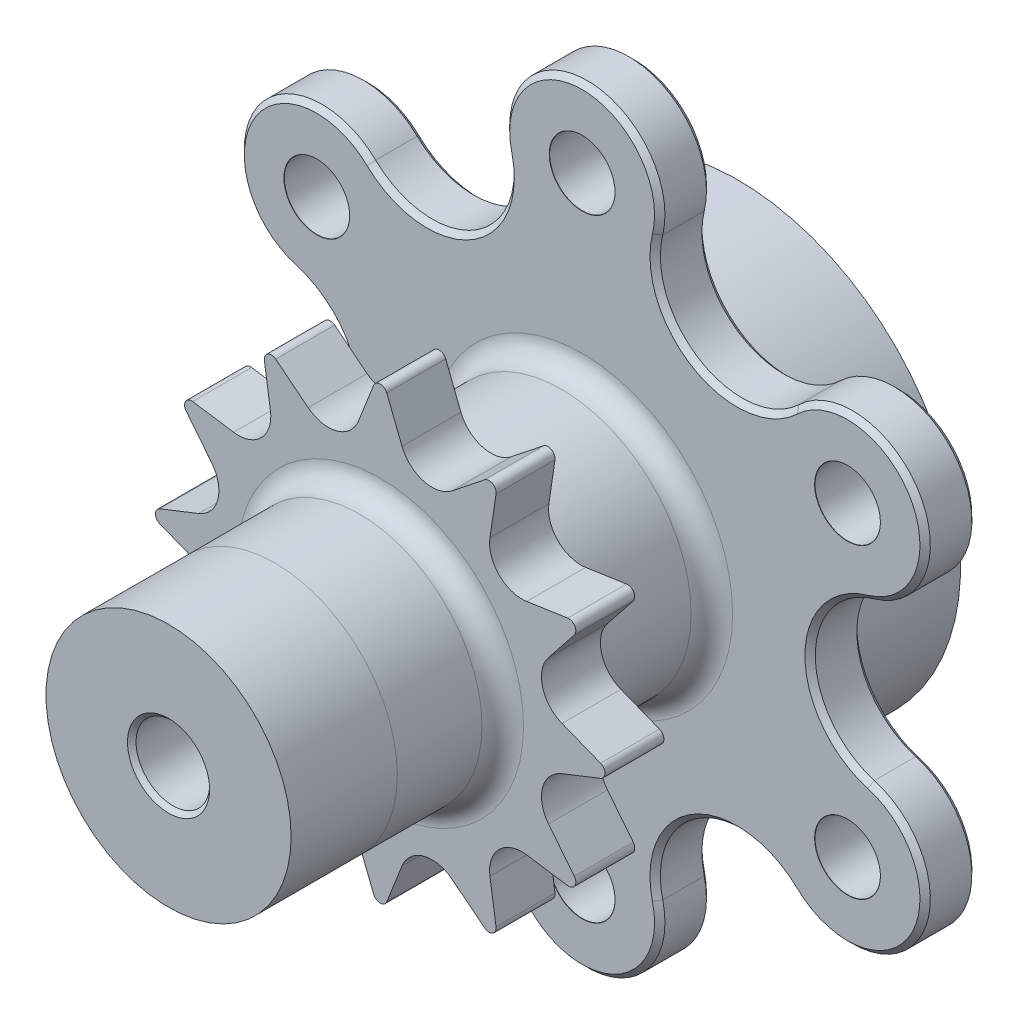
from build123d import *

# Parameters (mm, degrees)
SKETCH1_R                        = 47
BOSS_EXTRUDE1_DEPTH              = 6.35
F_8_0MM_DOWEL_HOLE1_D            = 8
F_8_0MM_DOWEL_HOLE1_CSINK_D      = 8.05
F_8_0MM_DOWEL_HOLE1_CSINK_ANGLE  = 90
CIRPATTERN1_COUNT                = 6
CUT_EXTRUDE1_DEPTH               = 67.770670957
CHAMFER1_SIZE                    = 0.635
SKETCH20_R                       = 27.265
SKETCH20_R_2                     = 23.455
BOSS_EXTRUDE5_DEPTH              = 12.7
SKETCH21_R                       = 15.875
BOSS_EXTRUDE6_DEPTH              = 17.5
SKETCH22_R                       = 27.5082
BOSS_EXTRUDE7_DEPTH              = 7.2136
CUT_EXTRUDE4_START               = -7.62
CUT_EXTRUDE4_DEPTH               = 7.62
CIRPATTERN2_COUNT                = 12
SKETCH23_R                       = 15
BOSS_EXTRUDE8_DEPTH              = 25.899999848
M10X1_0_TAPPED_HOLE1_D           = 9
M10X1_0_TAPPED_HOLE1_CSINK_D     = 10.05
M10X1_0_TAPPED_HOLE1_CSINK_ANGLE = 90
FILLET4_R                        = 2.54


with BuildPart() as part:
    # Sketch1 → Boss-Extrude1 (new body)
    with BuildSketch(Plane.XY):
        Circle(SKETCH1_R)
    extrude(amount=BOSS_EXTRUDE1_DEPTH)

    # Ø8.0mm Dowel Hole1 (through all)
    with Locations(Plane.XY.offset(6.35)):
        with Locations((0, -37.5)):
            f_8_0mm_dowel_hole1 = CounterSinkHole(F_8_0MM_DOWEL_HOLE1_D / 2, F_8_0MM_DOWEL_HOLE1_CSINK_D / 2, counter_sink_angle=F_8_0MM_DOWEL_HOLE1_CSINK_ANGLE)

    # CirPattern1: Ø8.0mm Dowel Hole1 ×6 about axis
    cirpattern1_axis = Axis((0, 0, 0), (0, 0, 1))
    for i in range(1, CIRPATTERN1_COUNT):
        add(f_8_0mm_dowel_hole1.rotate(cirpattern1_axis, i * 360 / CIRPATTERN1_COUNT), mode=Mode.SUBTRACT)

    # Sketch5 → Cut-Extrude1 (cut, through all)
    with BuildSketch(Plane.XY.offset(6.35)):
        with BuildLine():
            ThreePointArc((-9.226076329, 35.235156614), (-7.475493707, 43.362336892), (-1.8e-08, 47))
            ThreePointArc((-1.8e-08, 47), (-23.500000014, 40.70319397), (-40.703193985, 23.499999988))
            ThreePointArc((-40.703193985, 23.499999988), (-33.815138478, 28.1551359), (-25.901502569, 25.607594786))
            ThreePointArc((-25.901502569, 25.607594786), (-13.95, 24.162108766), (-9.226076329, 35.235156614))
        make_face()
        with BuildLine():
            ThreePointArc((25.901502569, 25.607594786), (33.815138801, 28.155135854), (40.703194311, 23.499999422))
            ThreePointArc((40.703194311, 23.499999422), (23.500000281, 40.703193816), (-1.8e-08, 47))
            ThreePointArc((-1.8e-08, 47), (7.475493696, 43.362336906), (9.226076329, 35.235156614))
            ThreePointArc((9.226076329, 35.235156614), (13.95, 24.162108766), (25.901502569, 25.607594786))
        make_face()
        with BuildLine():
            ThreePointArc((-35.127578899, 9.627561828), (-41.29063217, 15.207200992), (-40.703193985, 23.499999988))
            ThreePointArc((-40.703193985, 23.499999988), (-47, 9.11e-07), (-40.703194896, -23.49999841))
            ThreePointArc((-40.703194896, -23.49999841), (-41.29063183, -15.207200146), (-35.127578899, -9.627561828))
            ThreePointArc((-35.127578899, -9.627561828), (-27.9, 0), (-35.127578899, 9.627561828))
        make_face()
        with BuildLine():
            ThreePointArc((-40.703194896, -23.49999841), (-23.500000869, -40.703193476), (-1.71e-07, -47))
            ThreePointArc((-1.71e-07, -47), (-7.475493754, -43.362336832), (-9.226076329, -35.235156614))
            ThreePointArc((-9.226076329, -35.235156614), (-13.95, -24.162108766), (-25.901502569, -25.607594786))
            ThreePointArc((-25.901502569, -25.607594786), (-33.81513938, -28.155135771), (-40.703194896, -23.49999841))
        make_face()
        with BuildLine():
            ThreePointArc((-1.71e-07, -47), (23.500002394, -40.703192596), (40.703196828, -23.499995063))
            ThreePointArc((40.703196828, -23.499995063), (33.815141293, -28.155135499), (25.901502569, -25.607594786))
            ThreePointArc((25.901502569, -25.607594786), (13.95, -24.162108766), (9.226076329, -35.235156614))
            ThreePointArc((9.226076329, -35.235156614), (7.475493649, -43.362336966), (-1.71e-07, -47))
        make_face()
        with BuildLine():
            ThreePointArc((40.703196828, -23.499995063), (45.398514573, -12.164492367), (47, 0))
            ThreePointArc((47, 0), (45.398513922, 12.164494798), (40.703194311, 23.499999422))
            ThreePointArc((40.703194311, 23.499999422), (41.290632048, 15.207200689), (35.127578899, 9.627561828))
            ThreePointArc((35.127578899, 9.627561828), (27.9, 0), (35.127578899, -9.627561828))
            ThreePointArc((35.127578899, -9.627561828), (41.29063111, -15.207198354), (40.703196828, -23.499995063))
        make_face()
    extrude(amount=-CUT_EXTRUDE1_DEPTH, mode=Mode.SUBTRACT)

    # Chamfer1
    chamfer1_edges = [part.edges().sort_by_distance(p)[0] for p in [
        (13.95, -24.162108766, 0),
        (13.95, -24.162108766, 6.35),
        (-40.703193978, 23.5, 6.35),
        (0, 47, 0),
        (-13.95, 24.162108766, 0),
        (-40.703193978, 23.5, 0),
        (-13.95, 24.162108766, 6.35),
        (0, 47, 6.35),
        (0, -47, 6.35),
        (-40.703193978, -23.5, 6.35),
        (-13.95, -24.162108766, 0),
        (0, -47, 0),
        (-40.703193978, -23.5, 0),
        (-13.95, -24.162108766, 6.35),
        (40.703193978, -23.5, 6.35),
        (27.9, 0, 0),
        (40.703193978, 23.5, 0),
        (40.703193978, -23.5, 0),
        (40.703193978, 23.5, 6.35),
        (27.9, 0, 6.35),
        (13.95, 24.162108766, 0),
        (13.95, 24.162108766, 6.35),
        (-27.9, 0, 0),
        (-27.9, 0, 6.35),
    ]]
    chamfer(chamfer1_edges, length=CHAMFER1_SIZE)

    # Sketch20 → Boss-Extrude5 (add)
    with BuildSketch(Plane(origin=(0, 0, 0), x_dir=(-1, 0, 0), z_dir=(0, 0, -1))):
        Circle(SKETCH20_R)
        Circle(SKETCH20_R_2, mode=Mode.SUBTRACT)
    extrude(amount=BOSS_EXTRUDE5_DEPTH)

    # Sketch21 → Boss-Extrude6 (add)
    with BuildSketch(Plane.XY.offset(6.35)):
        Circle(SKETCH21_R)
    extrude(amount=BOSS_EXTRUDE6_DEPTH)

    # Sketch22 → Boss-Extrude7 (add)
    with BuildSketch(Plane.XY.offset(23.85)):
        Circle(SKETCH22_R)
    extrude(amount=BOSS_EXTRUDE7_DEPTH)

    # Sketch25 → Cut-Extrude4 (cut)
    with BuildSketch(Plane.XY.offset(31.0636).offset(CUT_EXTRUDE4_START)):
        with BuildLine():
            Line((-0.805715716, 26.959749783), (-2.663822441, 22.246002806))
            ThreePointArc((-2.663822441, 22.246002806), (-5.324614334, 19.871731224), (-8.816063498, 20.597514783))
            Line((-8.816063498, 20.597514783), (-12.782104613, 23.750686049))
            ThreePointArc((-12.782104613, 23.750686049), (-13.256994885, 23.93645554), (-13.7541, 23.822800012))
            ThreePointArc((-13.7541, 23.822800012), (-7.119646056, 26.570880815), (0, 27.5082))
            ThreePointArc((0, 27.5082), (-0.487333422, 27.358076017), (-0.805715716, 26.959749783))
        make_face()
    cut_extrude4 = extrude(amount=CUT_EXTRUDE4_DEPTH, mode=Mode.SUBTRACT)

    # CirPattern2: Cut-Extrude4 ×12 about axis
    cirpattern2_axis = Axis((0, 0, 0), (0, 0, 1))
    for i in range(1, CIRPATTERN2_COUNT):
        add(cut_extrude4.rotate(cirpattern2_axis, i * 360 / CIRPATTERN2_COUNT), mode=Mode.SUBTRACT)

    # Sketch23 → Boss-Extrude8 (add)
    with BuildSketch(Plane.XY.offset(31.0636)):
        Circle(SKETCH23_R)
    extrude(amount=BOSS_EXTRUDE8_DEPTH)

    # M10x1.0 Tapped Hole1 (through all)
    with Locations(Plane.XY.offset(56.963599848)):
        with Locations((0, 0)):
            CounterSinkHole(M10X1_0_TAPPED_HOLE1_D / 2, M10X1_0_TAPPED_HOLE1_CSINK_D / 2, counter_sink_angle=M10X1_0_TAPPED_HOLE1_CSINK_ANGLE)

    # Fillet4
    fillet4_edges = [part.edges().sort_by_distance(p)[0] for p in [
        (-15.875, 0, 6.35),
        (-15.875, 0, 23.85),
        (-15, 0, 31.0636),
    ]]
    fillet(fillet4_edges, radius=FILLET4_R)


solid = part.part
